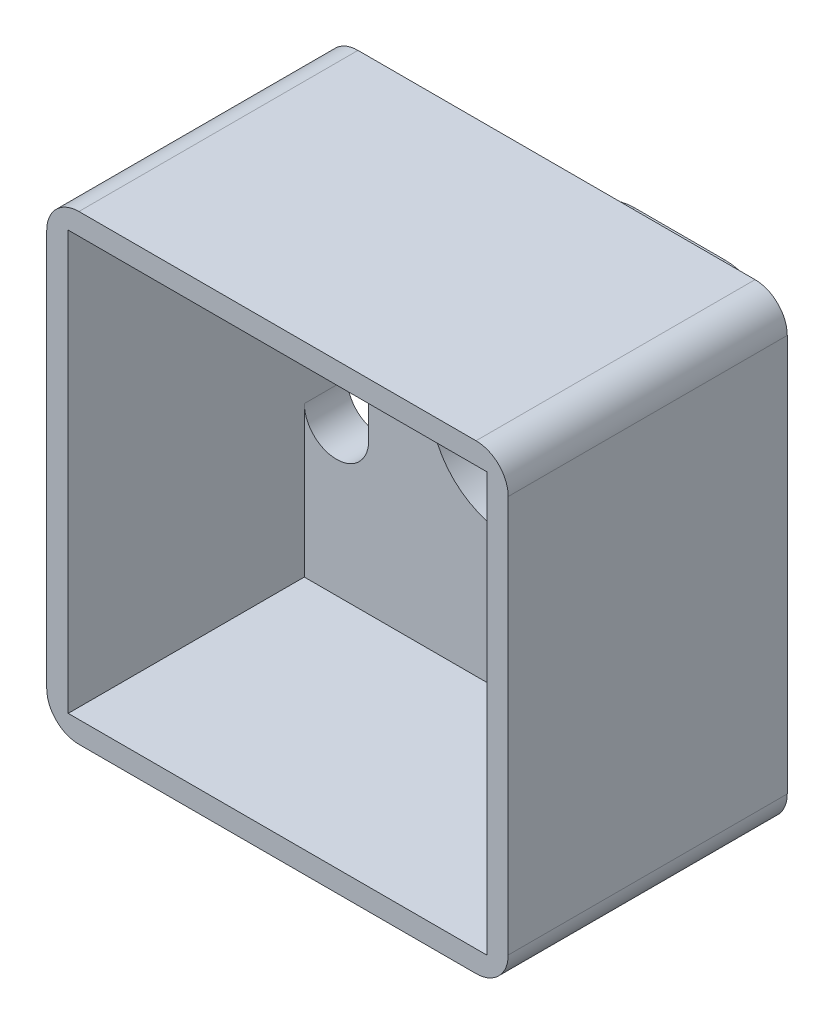
from build123d import *

# Parameters (mm, degrees)
SKETCH1_W           = 43
SKETCH1_H           = 43
BOSS_EXTRUDE1_DEPTH = 38
SKETCH3_R           = 3
SKETCH3_R_2         = 7.25
CUT_EXTRUDE4_DEPTH  = 38
SKETCH6_W           = 39
SKETCH6_H           = 39
CUT_EXTRUDE5_DEPTH  = 22
CUT_EXTRUDE8_START  = -12
SKETCH7_W           = 43
SKETCH7_H           = 43
SKETCH7_R           = 3
SKETCH7_W_2         = 18.4
SKETCH7_H_2         = 18.4
CUT_EXTRUDE8_DEPTH  = 12
FILLET2_R           = 5
FILLET3_R           = 3


with BuildPart() as part:
    # Sketch1 → Boss-Extrude1 (new body)
    with BuildSketch(Plane(origin=(0, 0, 0), x_dir=(0, 1, 0), z_dir=(0, 0, 1))):
        with Locations((-19.5, 19.5)):
            Rectangle(SKETCH1_W, SKETCH1_H)
    extrude(amount=BOSS_EXTRUDE1_DEPTH)

    # Sketch3 → Cut-Extrude4 (cut)
    with BuildSketch(Plane.XY.offset(38)):
        with Locations((-20, -3.506761261)):
            Circle(SKETCH3_R)
        with Locations((-20, -19)):
            Circle(SKETCH3_R_2)
        with BuildLine():
            Line((-6, -13), (-6, -25))
            ThreePointArc((-6, -25), (-3, -28), (0, -25))
            Line((0, -25), (0, -13))
            ThreePointArc((0, -13), (-3, -10), (-6, -13))
        make_face()
        with BuildLine():
            Line((-33, -13), (-33, -25))
            ThreePointArc((-33, -25), (-36, -28), (-39, -25))
            Line((-39, -25), (-39, -13))
            ThreePointArc((-39, -13), (-36, -10), (-33, -13))
        make_face()
    extrude(amount=-CUT_EXTRUDE4_DEPTH, mode=Mode.SUBTRACT)

    # Sketch6 → Cut-Extrude5 (cut)
    with BuildSketch(Plane.XY.offset(38)):
        with Locations((-19.5, -19.5)):
            Rectangle(SKETCH6_W, SKETCH6_H)
    extrude(amount=-CUT_EXTRUDE5_DEPTH, mode=Mode.SUBTRACT)

    # Sketch7 → Cut-Extrude8 (cut)
    with BuildSketch(Plane(origin=(0, 0, 0), x_dir=(1, 0, 0), z_dir=(0, 0, -1)).offset(CUT_EXTRUDE8_START)):
        with Locations((-19.5, 19.5)):
            Rectangle(SKETCH7_W, SKETCH7_H)
        with Locations((-20, 3.506761261)):
            Circle(SKETCH7_R, mode=Mode.SUBTRACT)
        with Locations((-20.012556467, 19.015852406)):
            Rectangle(SKETCH7_W_2, SKETCH7_H_2, mode=Mode.SUBTRACT)
        with BuildLine():
            Line((-33, 25), (-33, 13))
            ThreePointArc((-33, 13), (-36, 10), (-39, 13))
            Line((-39, 13), (-39, 25))
            ThreePointArc((-39, 25), (-36, 28), (-33, 25))
        make_face(mode=Mode.SUBTRACT)
        with BuildLine():
            ThreePointArc((0, 13), (-3, 10), (-6, 13))
            Line((-6, 13), (-6, 25))
            ThreePointArc((-6, 25), (-3, 28), (0, 25))
            Line((0, 25), (0, 13))
        make_face(mode=Mode.SUBTRACT)
    extrude(amount=CUT_EXTRUDE8_DEPTH, mode=Mode.SUBTRACT)

    # Fillet2
    fillet2_edges = [part.edges().sort_by_distance(p)[0] for p in [
        (-10.812556467, -9.815852406, 6),
        (-10.812556467, -28.215852406, 6),
        (-29.212556467, -28.215852406, 6),
        (-29.212556467, -9.815852406, 6),
    ]]
    fillet(fillet2_edges, radius=FILLET2_R)

    # Fillet3
    fillet3_edges = [part.edges().sort_by_distance(p)[0] for p in [
        (-41, -41, 25),
        (2, -41, 25),
        (2, 2, 25),
        (-41, 2, 25),
    ]]
    fillet(fillet3_edges, radius=FILLET3_R)


solid = part.part
